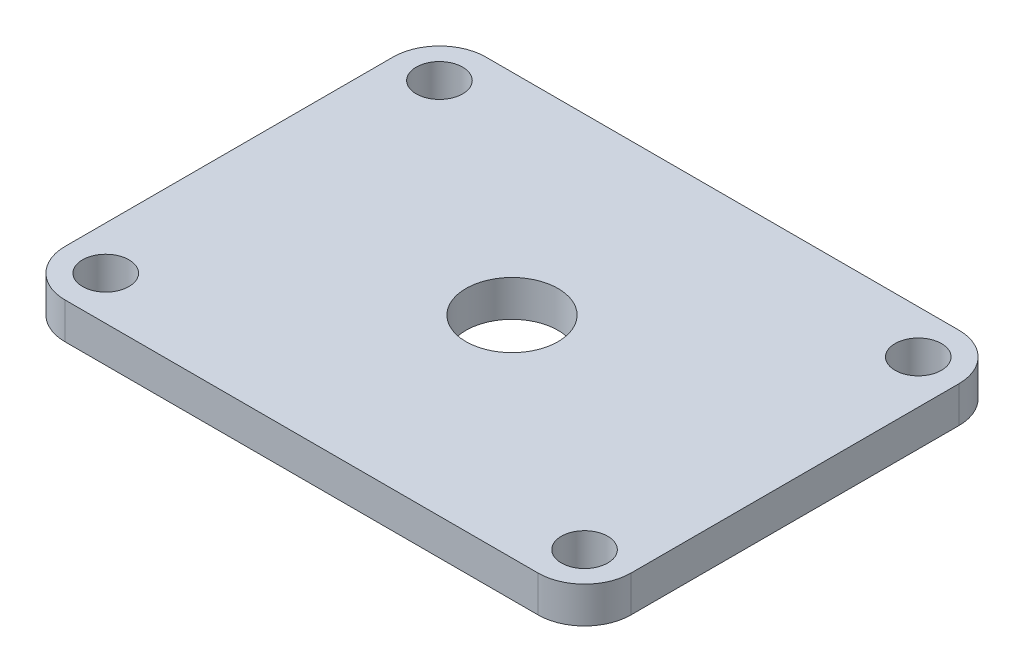
from build123d import *

# Parameters (mm, degrees)
SKETCH1_R           = 3.175
SKETCH1_R_2         = 1.6
BOSS_EXTRUDE1_DEPTH = 2.5


with BuildPart() as part:
    # Sketch1 → Boss-Extrude1 (new body)
    with BuildSketch(Plane(origin=(0, 0, 0), x_dir=(1, 0, 0), z_dir=(0, 1, 0))):
        with BuildLine():
            Line((3.2, 0), (35.8, 0))
            ThreePointArc((35.8, 0), (38.0627417, 0.9372583), (39, 3.2))
            Line((39, 3.2), (39, 25.8))
            ThreePointArc((39, 25.8), (38.0627417, 28.0627417), (35.8, 29))
            Line((35.8, 29), (3.2, 29))
            ThreePointArc((3.2, 29), (0.9372583, 28.0627417), (0, 25.8))
            Line((0, 25.8), (0, 3.2))
            ThreePointArc((0, 3.2), (0.9372583, 0.9372583), (3.2, 0))
        make_face()
        with Locations(Location((19.5, 14.5, 0), (0, 0, 270))):
            Circle(SKETCH1_R, mode=Mode.SUBTRACT)
        with Locations(Location((3, 26, 0), (0, 0, 270))):
            Circle(SKETCH1_R_2, mode=Mode.SUBTRACT)
        with Locations(Location((36, 26, 0), (0, 0, 270))):
            Circle(SKETCH1_R_2, mode=Mode.SUBTRACT)
        with Locations(Location((36, 3, 0), (0, 0, 270))):
            Circle(SKETCH1_R_2, mode=Mode.SUBTRACT)
        with Locations(Location((3, 3, 0), (0, 0, 270))):
            Circle(SKETCH1_R_2, mode=Mode.SUBTRACT)
    extrude(amount=BOSS_EXTRUDE1_DEPTH)


solid = part.part
